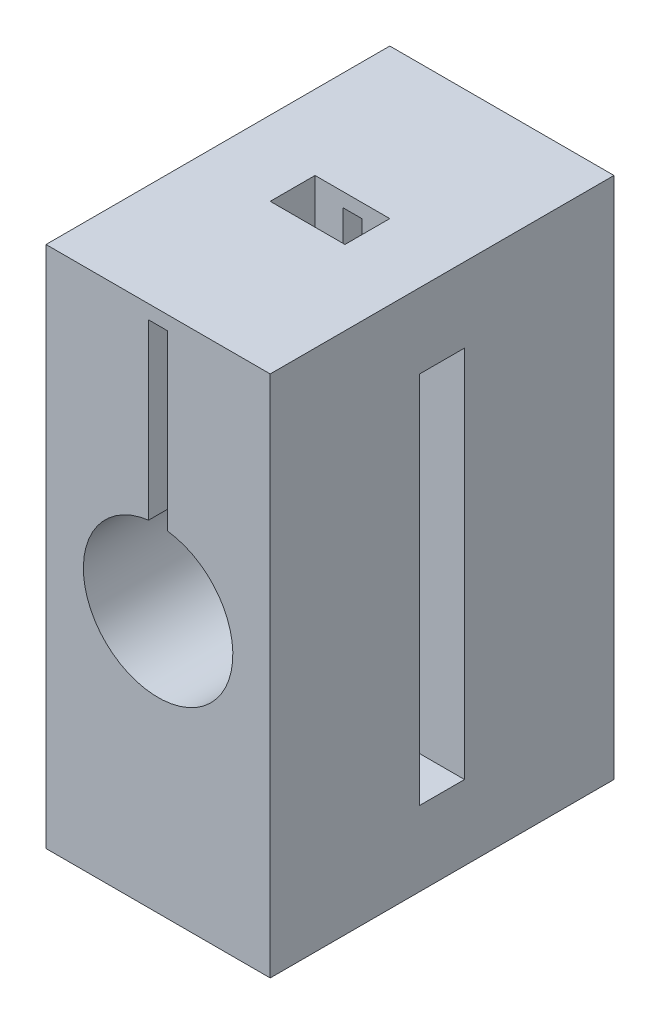
from build123d import *

# Parameters (mm, degrees)
SKETCH1_W           = 15
SKETCH1_H           = 35
SKETCH1_W_2         = 1.272906456
SKETCH1_H_2         = 13.426112712
SKETCH1_R           = 1.6
BOSS_EXTRUDE4_DEPTH = 10
SKETCH1_9_R         = 2.4
SKETCH1_9_R_2       = 1.6
CUT_EXTRUDE3_DEPTH  = 8
SKETCH1_10_W        = 15
SKETCH1_10_H        = 5
SKETCH1_10_W_2      = 5
BOSS_EXTRUDE5_DEPTH = 13
BOSS_EXTRUDE6_START = 13
SKETCH1_11_W        = 15
SKETCH1_11_H        = 35
BOSS_EXTRUDE6_DEPTH = 10


with BuildPart() as part:
    # Sketch1 → Boss-Extrude4 (new body)
    with BuildSketch(Plane.XY):
        Rectangle(SKETCH1_W, SKETCH1_H)
        with Locations((0, 9.851749103)):
            Rectangle(SKETCH1_W_2, SKETCH1_H_2, mode=Mode.SUBTRACT)
        Circle(SKETCH1_R, mode=Mode.SUBTRACT)
    extrude(amount=BOSS_EXTRUDE4_DEPTH)

    # Sketch1<9> → Cut-Extrude3 (cut)
    with BuildSketch(Plane.XY):
        Circle(SKETCH1_9_R)
        Circle(SKETCH1_9_R_2, mode=Mode.SUBTRACT)
    extrude(amount=CUT_EXTRUDE3_DEPTH, mode=Mode.SUBTRACT)

    # Sketch1<10> → Boss-Extrude5 (add)
    with BuildSketch(Plane.XY):
        with Locations((0, -15)):
            Rectangle(SKETCH1_10_W, SKETCH1_10_H)
        with Locations((-5, 15)):
            Rectangle(SKETCH1_10_W_2, SKETCH1_10_H)
        with Locations((5, 15)):
            Rectangle(SKETCH1_10_W_2, SKETCH1_10_H)
    extrude(amount=BOSS_EXTRUDE5_DEPTH)

    # Sketch1<11> → Boss-Extrude6 (add)
    with BuildSketch(Plane.XY.offset(BOSS_EXTRUDE6_START)):
        Rectangle(SKETCH1_11_W, SKETCH1_11_H)
        with BuildLine():
            Line((-0.636453228, 16.564805459), (0.636453228, 16.564805459))
            Line((0.636453228, 16.564805459), (0.636453228, 4.959327302))
            ThreePointArc((0.636453228, 4.959327302), (0, -5), (-0.636453228, 4.959327302))
            Line((-0.636453228, 4.959327302), (-0.636453228, 16.564805459))
        make_face(mode=Mode.SUBTRACT)
    extrude(amount=BOSS_EXTRUDE6_DEPTH)


solid = part.part
